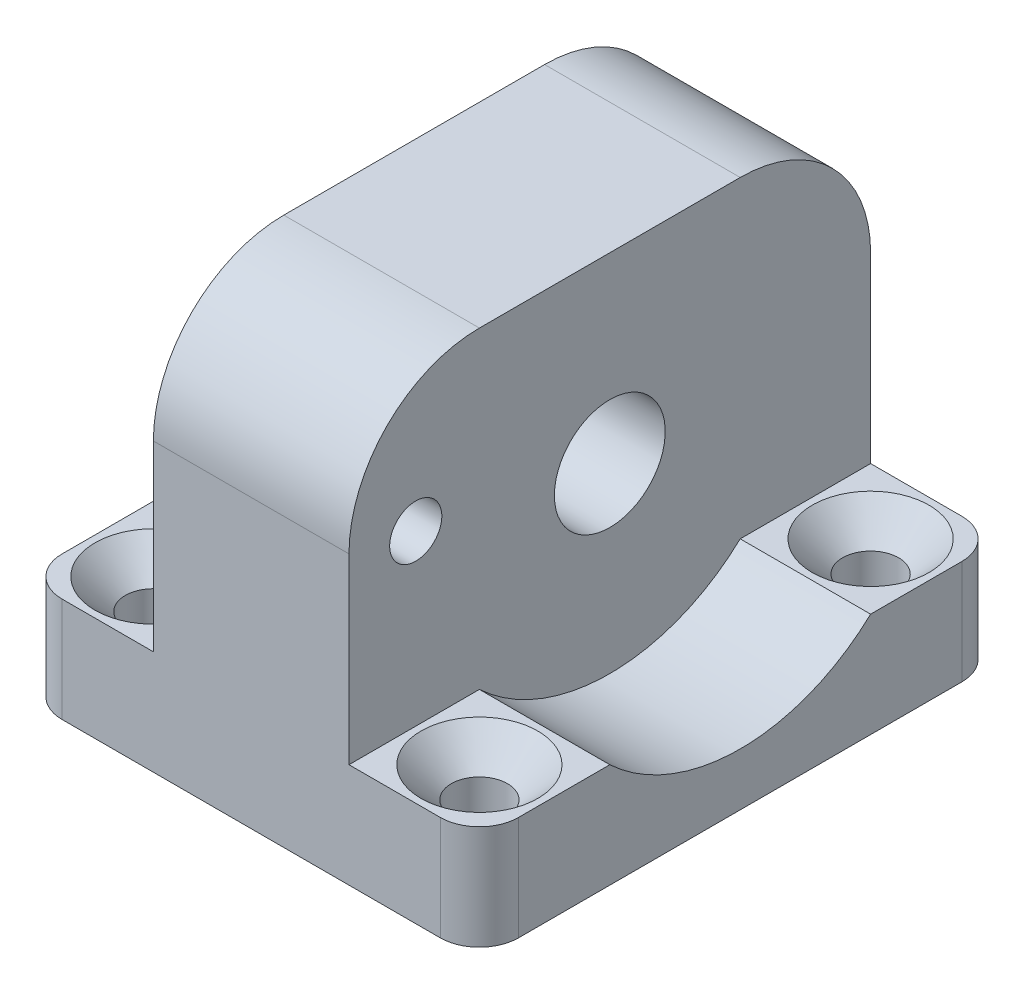
from build123d import *

# Parameters (mm, degrees)
SKETCH_2_W                   = 35
SKETCH_2_H                   = 40
EXTRUDE_1_DEPTH              = 8
SKETCH_3_R                   = 2
CUT_EXTRUDE_2_DEPTH          = 10
SKETCH_4_W                   = 15
SKETCH_4_H                   = 40
EXTRUDE_2_DEPTH              = 24
SKETCH_5_R                   = 6.2
CUT_EXTRUDE_3_DEPTH          = 46.265881191
SKETCH_6_R                   = 10
CUT_EXTRUDE_4_DEPTH          = 3
FILLET_2_R                   = 3
FILLET_3_R                   = 10
HOLE_WIZARD_M4_1_D           = 4.3
HOLE_WIZARD_M4_1_DEPTH       = 8
HOLE_WIZARD_M4_1_CSINK_D     = 8.96
HOLE_WIZARD_M4_1_CSINK_ANGLE = 90
SKETCH_9_R                   = 10
EXTRUDE_3_DEPTH              = 3
SKETCH_10_R                  = 4.25
CUT_EXTRUDE_5_DEPTH          = 3
CUT_EXTRUDE_6_DEPTH          = 5
SKETCH_14_R                  = 6.2
SKETCH_14_R_2                = 4.25
EXTRUDE_4_DEPTH              = 12
SKETCH_15_R                  = 2
CUT_EXTRUDE_8_DEPTH          = 22


with BuildPart() as part:
    # 草图2 → 凸台-拉伸1 (new body)
    with BuildSketch(Plane(origin=(0, 0, 0), x_dir=(1, 0, 0), z_dir=(0, 1, 0))):
        Rectangle(SKETCH_2_W, SKETCH_2_H)
    extrude(amount=EXTRUDE_1_DEPTH)

    # 草图3 → 切除-拉伸2 (cut)
    with BuildSketch(Plane(origin=(0, 8, 0), x_dir=(1, 0, 0), z_dir=(0, 1, 0))):
        with Locations(Location((12.5, 15, 0), (0, 0, 270))):
            Circle(SKETCH_3_R)
        with Locations(Location((-12.5, 15, 0), (0, 0, 270))):
            Circle(SKETCH_3_R)
        with Locations(Location((-12.5, -15, 0), (0, 0, 270))):
            Circle(SKETCH_3_R)
        with Locations(Location((12.5, -15, 0), (0, 0, 270))):
            Circle(SKETCH_3_R)
    extrude(amount=-CUT_EXTRUDE_2_DEPTH, mode=Mode.SUBTRACT)

    # 草图4 → 凸台-拉伸2 (add)
    with BuildSketch(Plane(origin=(0, 8, 0), x_dir=(1, 0, 0), z_dir=(0, 1, 0))):
        Rectangle(SKETCH_4_W, SKETCH_4_H)
    extrude(amount=EXTRUDE_2_DEPTH)

    # 草图5 → 切除-拉伸3 (cut, through all)
    with BuildSketch(Plane(origin=(7.5, 0, 0), x_dir=(0, 0, -1), z_dir=(1, 0, 0))):
        with Locations((0, 18)):
            Circle(SKETCH_5_R)
    extrude(amount=-CUT_EXTRUDE_3_DEPTH, mode=Mode.SUBTRACT)

    # 草图6 → 切除-拉伸4 (cut)
    with BuildSketch(Plane(origin=(7.5, 0, 0), x_dir=(0, 0, -1), z_dir=(1, 0, 0))):
        with Locations((0, 18)):
            Circle(SKETCH_6_R)
    extrude(amount=-CUT_EXTRUDE_4_DEPTH, mode=Mode.SUBTRACT)

    # 圆角2
    fillet_2_edges = [part.edges().sort_by_distance(p)[0] for p in [
        (17.5, 4, -20),
        (-17.5, 4, -20),
        (-17.5, 4, 20),
        (17.5, 4, 20),
    ]]
    fillet(fillet_2_edges, radius=FILLET_2_R)

    # 圆角3
    fillet_3_edges = [part.edges().sort_by_distance(p)[0] for p in [
        (0, 32, 20),
        (0, 32, -20),
    ]]
    fillet(fillet_3_edges, radius=FILLET_3_R)

    # M4 六角凹锥坑螺钉的锥形沉头孔1
    with Locations(Plane(origin=(0, 8, 0), x_dir=(1, 0, 0), z_dir=(0, 1, 0))):
        with Locations((12.5, -15), (12.5, 15), (-12.5, 15), (-12.5, -15)):
            CounterSinkHole(HOLE_WIZARD_M4_1_D / 2, HOLE_WIZARD_M4_1_CSINK_D / 2, depth=HOLE_WIZARD_M4_1_DEPTH, counter_sink_angle=HOLE_WIZARD_M4_1_CSINK_ANGLE)

    # 草图9 → 凸台-拉伸3 (add)
    with BuildSketch(Plane(origin=(7.5, 0, 0), x_dir=(0, 0, -1), z_dir=(1, 0, 0))):
        with Locations((0, 18)):
            Circle(SKETCH_9_R)
    extrude(amount=-EXTRUDE_3_DEPTH)

    # 草图10 → 切除-拉伸5 (cut)
    with BuildSketch(Plane.ZY.offset(-4.5)):
        with Locations((0, 18)):
            Circle(SKETCH_10_R)
    extrude(amount=-CUT_EXTRUDE_5_DEPTH, mode=Mode.SUBTRACT)

    # 草图12 → 切除-拉伸6 (cut, symmetric)
    with BuildSketch(Plane.ZY.offset(12.5)):
        with BuildLine():
            Line((-10, 8), (10, 8))
            ThreePointArc((10, 8), (0, 4.045383588), (-10, 8))
        make_face()
    cut_extrude_6 = extrude(amount=CUT_EXTRUDE_6_DEPTH, both=True, mode=Mode.SUBTRACT)

    # 镜向1: 切除-拉伸6 across plane
    add(cut_extrude_6.mirror(Plane.ZY), mode=Mode.SUBTRACT)

    # 草图14 → 凸台-拉伸4 (add)
    with BuildSketch(Plane.ZY.offset(-4.5)):
        with Locations((0, 18)):
            Circle(SKETCH_14_R)
        with Locations((0, 18)):
            Circle(SKETCH_14_R_2, mode=Mode.SUBTRACT)
    extrude(amount=EXTRUDE_4_DEPTH)

    # 草图15 → 切除-拉伸8 (cut)
    with BuildSketch(Plane.ZY.offset(7.5)):
        with Locations((14.883032336, 20.9575309)):
            Circle(SKETCH_15_R)
    extrude(amount=-CUT_EXTRUDE_8_DEPTH, mode=Mode.SUBTRACT)


solid = part.part
